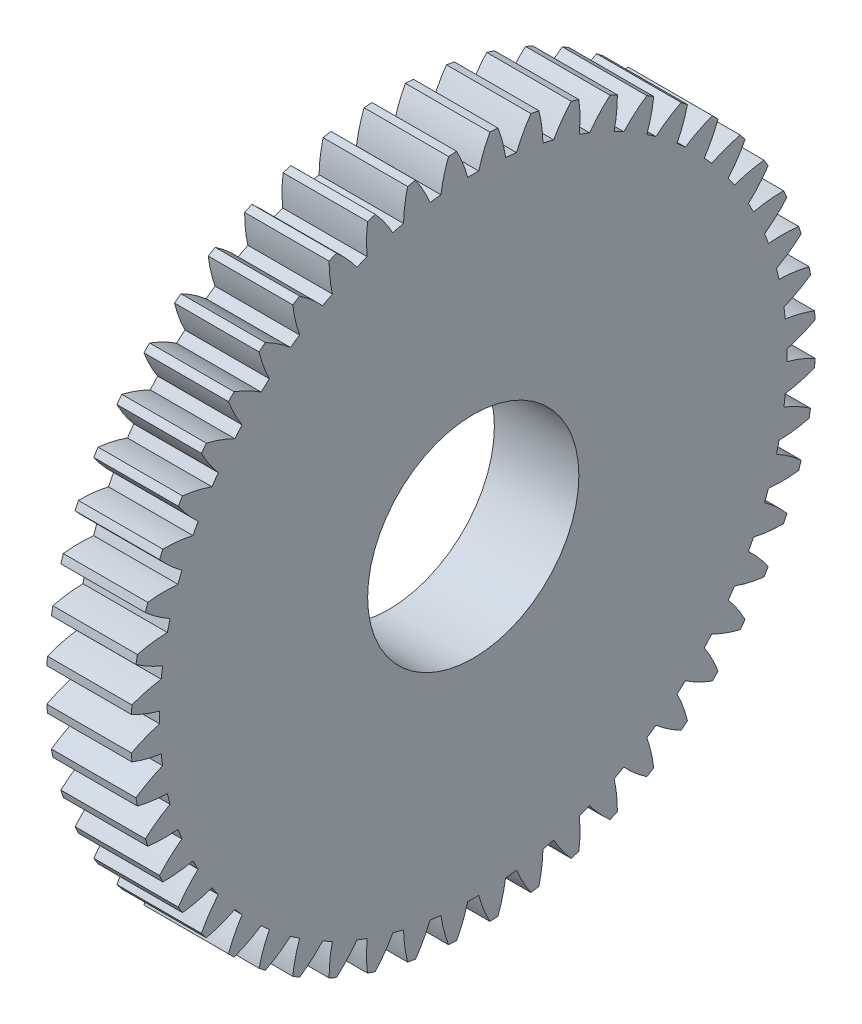
from build123d import *

# Parameters (mm, degrees)
BASPROSKE_W     = 4
BASPROSKE_H     = 16.2
TOOTHCUT_DEPTH  = 24.256826955
TEETHCUTS_COUNT = 52
TEETHCUTS_ANGLE = 353.076923077
BORSKE_R        = 5
BORE_DEPTH      = 50.0000508


with BuildPart() as part:
    # BasProSke → Base-Revolve (revolve)
    with BuildSketch(Plane(origin=(0, 0, 0), x_dir=(1, 0, 0), z_dir=(0, 1, 0)), mode=Mode.PRIVATE) as base_revolve_sk:
        with Locations((2, 8.1)):
            Rectangle(BASPROSKE_W, BASPROSKE_H)
    revolve(base_revolve_sk.sketch.rotate(Axis((-10, 0, 0), (1, 0, 0)), 180), axis=Axis((-10, 0, 0), (1, 0, 0)))

    # TooCutSke → ToothCut (cut, through all)
    with BuildSketch(Plane(origin=(0, 0, 0), x_dir=(0, 0, -1), z_dir=(1, 0, 0))):
        with BuildLine():
            ThreePointArc((0.261792698, 14.846692075), (0, 14.849), (-0.261792698, 14.846692075))
            ThreePointArc((-0.261792698, 14.846692075), (-0.491479775, 15.542000731), (-0.801039214, 16.2056145))
            ThreePointArc((-0.801039214, 16.2056145), (0, 16.2254), (0.801039214, 16.2056145))
            ThreePointArc((0.801039214, 16.2056145), (0.491479775, 15.542000731), (0.261792698, 14.846692075))
        make_face()
    toothcut = extrude(amount=TOOTHCUT_DEPTH, mode=Mode.SUBTRACT)

    # TeethCuts: ToothCut ×52 about axis
    teethcuts_axis = Axis((-10, 0, 0), (1, 0, 0))
    for i in range(1, TEETHCUTS_COUNT):
        add(toothcut.rotate(teethcuts_axis, i * TEETHCUTS_ANGLE / (TEETHCUTS_COUNT - 1)), mode=Mode.SUBTRACT)

    # BorSke → Bore (cut, symmetric)
    with BuildSketch(Plane(origin=(0, 0, 0), x_dir=(0, 0, -1), z_dir=(1, 0, 0))):
        with Locations(Location((0, 0, 0), (0, 0, 180))):
            Circle(BORSKE_R)
    extrude(amount=BORE_DEPTH, both=True, mode=Mode.SUBTRACT)


solid = part.part
